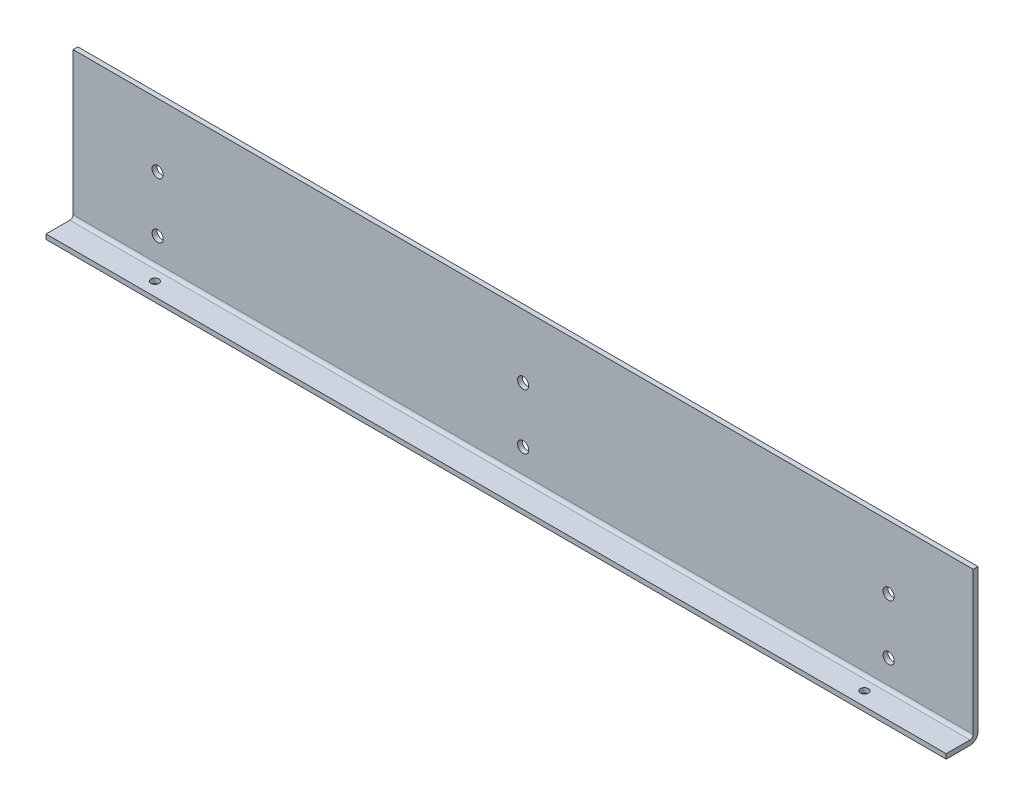
from build123d import *

# Parameters (mm, degrees)
SKETCH_1_W          = 566.5
SKETCH_1_H          = 95
EXTRUDE_1_DEPTH     = 3
SKETCH_2_W          = 566.5
SKETCH_2_H          = 3
EXTRUDE_2_DEPTH     = 17
SKETCH_3_R          = 3.5
CUT_EXTRUDE_1_DEPTH = 575.661857095
SKETCH_4_R          = 2.5
CUT_EXTRUDE_2_DEPTH = 575.270189023
FILLET_1_R          = 5
FILLET_2_R          = 2


with BuildPart() as part:
    # 스케치1 → 보스-돌출1 (new body)
    with BuildSketch(Plane.XY):
        with Locations((283.25, 47.5)):
            Rectangle(SKETCH_1_W, SKETCH_1_H)
    extrude(amount=EXTRUDE_1_DEPTH)

    # 스케치2 → 보스-돌출2 (add)
    with BuildSketch(Plane.XY.offset(3)):
        with Locations((283.25, 1.5)):
            Rectangle(SKETCH_2_W, SKETCH_2_H)
    extrude(amount=EXTRUDE_2_DEPTH)

    # 스케치3 → 컷-돌출1 (cut, through all)
    with BuildSketch(Plane.XY.offset(3)):
        with Locations((53.25, 55)):
            Circle(SKETCH_3_R)
        with Locations((53.25, 20)):
            Circle(SKETCH_3_R)
        with Locations((283.25, 55)):
            Circle(SKETCH_3_R)
        with Locations((283.25, 20)):
            Circle(SKETCH_3_R)
        with Locations((513.25, 55)):
            Circle(SKETCH_3_R)
        with Locations((513.25, 20)):
            Circle(SKETCH_3_R)
    extrude(amount=-CUT_EXTRUDE_1_DEPTH, mode=Mode.SUBTRACT)

    # 스케치4 → 컷-돌출2 (cut, through all)
    with BuildSketch(Plane(origin=(0, 3, 0), x_dir=(1, 0, 0), z_dir=(0, 1, 0))):
        with Locations(Location((60, -11.5, 0), (0, 0, 270))):
            Circle(SKETCH_4_R)
        with Locations(Location((506.5, -11.5, 0), (0, 0, 270))):
            Circle(SKETCH_4_R)
    extrude(amount=-CUT_EXTRUDE_2_DEPTH, mode=Mode.SUBTRACT)

    # 필렛1
    fillet_1_edges = [part.edges().sort_by_distance(p)[0] for p in [
        (283.25, 0, 0),
    ]]
    fillet(fillet_1_edges, radius=FILLET_1_R)

    # 필렛2
    fillet_2_edges = [part.edges().sort_by_distance(p)[0] for p in [
        (283.25, 3, 3),
    ]]
    fillet(fillet_2_edges, radius=FILLET_2_R)


solid = part.part
